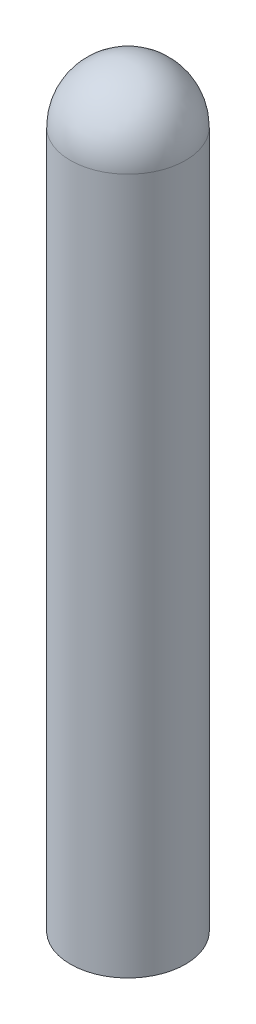
from build123d import *

# Parameters (mm, degrees)
SKETCH1_R           = 7.85
SKETCH1_R_2         = 6.9
BOSS_EXTRUDE1_DEPTH = 95


with BuildPart() as part:
    # Sketch1 → Boss-Extrude1 (new body)
    with BuildSketch(Plane(origin=(0, 0, 0), x_dir=(1, 0, 0), z_dir=(0, 1, 0))):
        with Locations(Location((0, 0, 0), (0, 0, 270))):
            Circle(SKETCH1_R)
        with Locations(Location((0, 0, 0), (0, 0, 270))):
            Circle(SKETCH1_R_2, mode=Mode.SUBTRACT)
    extrude(amount=BOSS_EXTRUDE1_DEPTH)

    # Sketch2 → Revolve2 (revolve)
    with BuildSketch(Plane(origin=(0, 95, 0), x_dir=(1, 0, 0), z_dir=(0, 1, 0))):
        with BuildLine():
            Line((0, 6.9), (0, 7.85))
            ThreePointArc((0, 7.85), (-7.85, 0), (0, -7.85))
            Line((0, -7.85), (0, -6.9))
            ThreePointArc((0, -6.9), (-6.9, 0), (0, 6.9))
        make_face()
    revolve(axis=Axis((0, 95, -7.85), (0, 0, 1)))


solid = part.part
